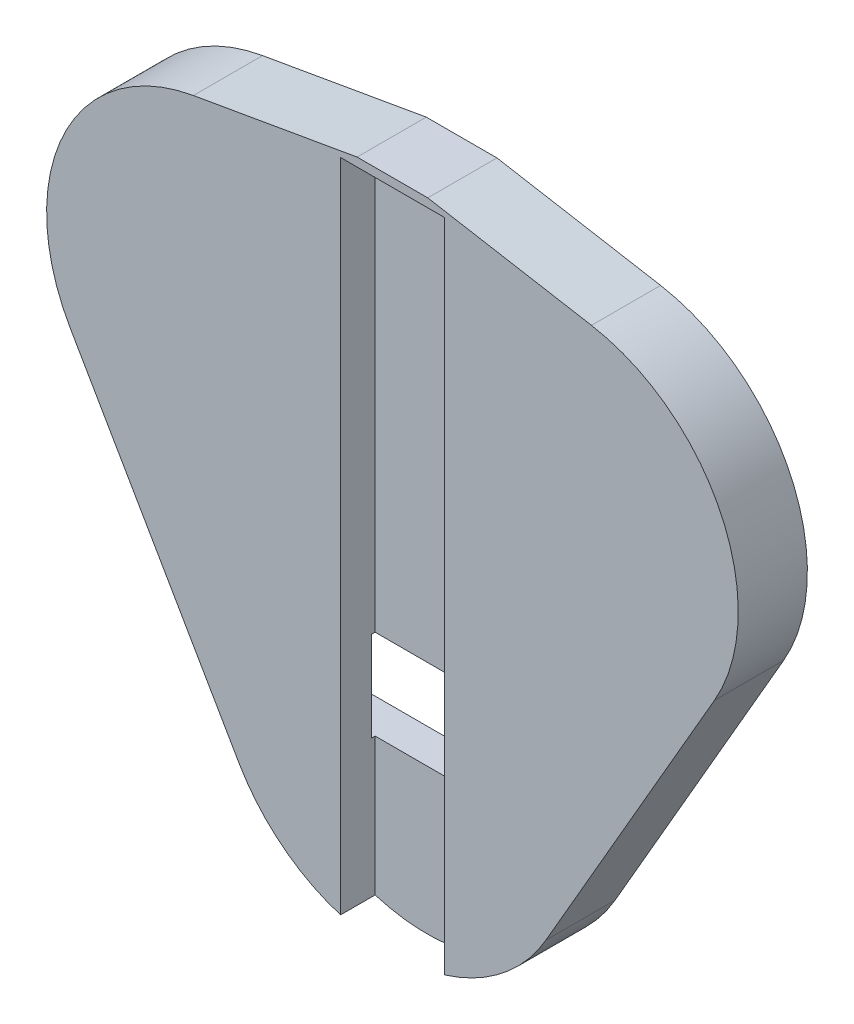
from build123d import *

# Parameters (mm, degrees)
BOSS_EXTRUDE1_START = -36.5
BOSS_EXTRUDE1_DEPTH = 4
CUT_EXTRUDE1_START  = -21.50833
SKETCH2_W           = 6
SKETCH2_H           = 3
CUT_EXTRUDE1_DEPTH  = 38.387495
CUT_EXTRUDE2_DEPTH  = 2.2


with BuildPart() as part:
    # Sketch1 → Boss-Extrude1 (new body)
    with BuildSketch(Plane.XY.offset(BOSS_EXTRUDE1_START)):
        with BuildLine():
            Line((-2.043305467, 17.379165125), (-11.512304293, 15.726530305))
            ThreePointArc((-11.512304293, 15.726530305), (-19.035877705, 9.969093149), (-18.626760389, 0.504165125))
            Line((-18.626760389, 0.504165125), (-8.876760389, -16.383330249))
            ThreePointArc((-8.876760389, -16.383330249), (0, -21.508330249), (8.876760389, -16.383330249))
            Line((8.876760389, -16.383330249), (18.626760389, 0.504165125))
            ThreePointArc((18.626760389, 0.504165125), (19.035877705, 9.969093149), (11.512304293, 15.726530305))
            Line((11.512304293, 15.726530305), (2.043305467, 17.379165125))
            Line((2.043305467, 17.379165125), (-2.043305467, 17.379165125))
        make_face()
    extrude(amount=BOSS_EXTRUDE1_DEPTH)

    # Sketch2 → Cut-Extrude1 (cut)
    with BuildSketch(Plane(origin=(0, 0, 0), x_dir=(1, 0, 0), z_dir=(0, 1, 0)).offset(CUT_EXTRUDE1_START)):
        with Locations((0, 33)):
            Rectangle(SKETCH2_W, SKETCH2_H)
    extrude(amount=CUT_EXTRUDE1_DEPTH, mode=Mode.SUBTRACT)

    # Sketch4 → Cut-Extrude2 (cut)
    with BuildSketch(Plane(origin=(0, 0, -36.5), x_dir=(-1, 0, 0), z_dir=(0, 0, -1))):
        Polygon((-9.1, -2.9), (-9.1, -13.1), (9.1, -13.1), (9.1, -2.9), (4.9, -2.9), (4.9, -7.9), (-4.9, -7.9), (-4.9, -2.9), align=None)
    extrude(amount=-CUT_EXTRUDE2_DEPTH, mode=Mode.SUBTRACT)


solid = part.part
